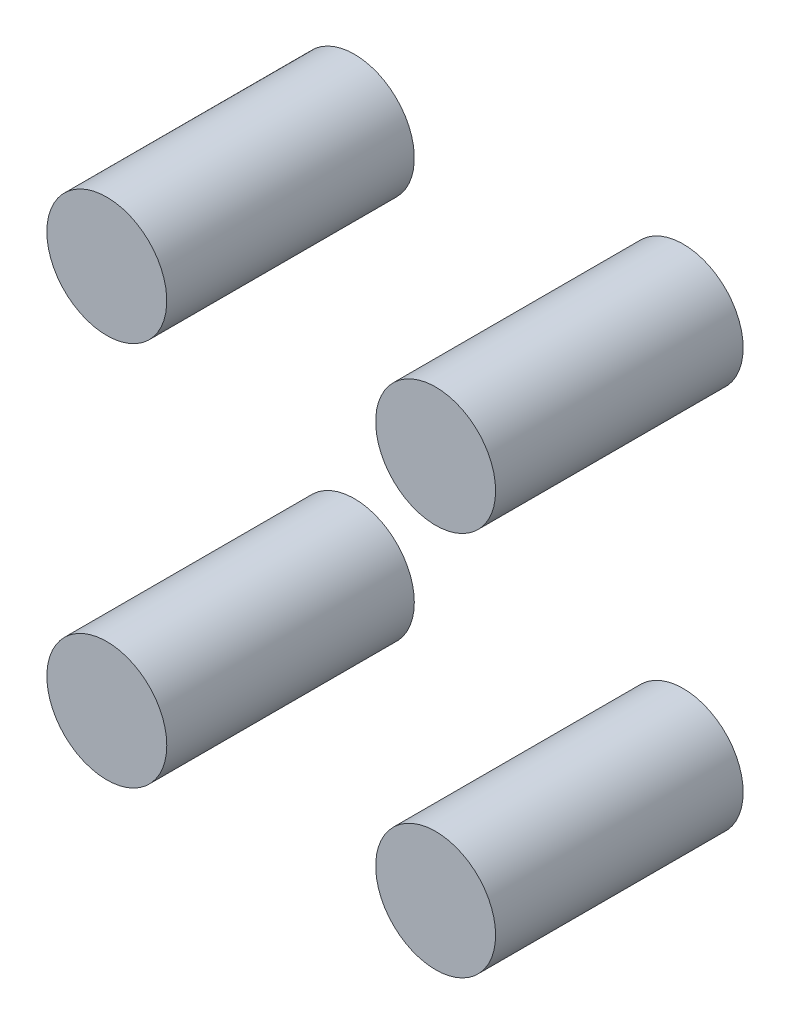
from build123d import *

# Parameters (mm, degrees)
SKETCH1_R             = 9.688899653
BOSS_EXTRUDE1_DEPTH   = 40
BOSS_EXTRUDE1_2_DEPTH = 40
BOSS_EXTRUDE1_3_DEPTH = 40
BOSS_EXTRUDE1_4_DEPTH = 40


with BuildPart() as part:
    # Sketch1 → Boss-Extrude1 (new body)
    with BuildSketch(Plane.XY):
        with Locations((52.818543782, 62.240299842)):
            Circle(SKETCH1_R)
    extrude(amount=BOSS_EXTRUDE1_DEPTH)


with BuildPart() as body_2:
    # Sketch1 → Boss-Extrude1 2 (new body)
    with BuildSketch(Plane.XY):
        with Locations((52.818543782, 0.050367456)):
            Circle(SKETCH1_R)
    extrude(amount=BOSS_EXTRUDE1_2_DEPTH)


with BuildPart() as body_3:
    # Sketch1 → Boss-Extrude1 3 (new body)
    with BuildSketch(Plane.XY):
        with Locations(Location((-0.316192678, 62.240299842, 0), (0, 0, 180))):
            Circle(SKETCH1_R)
    extrude(amount=BOSS_EXTRUDE1_3_DEPTH)


with BuildPart() as body_4:
    # Sketch1 → Boss-Extrude1 4 (new body)
    with BuildSketch(Plane.XY):
        with Locations((-0.316192678, 0.050367456)):
            Circle(SKETCH1_R)
    extrude(amount=BOSS_EXTRUDE1_4_DEPTH)


solid = Compound([part.part, body_2.part, body_3.part, body_4.part])
